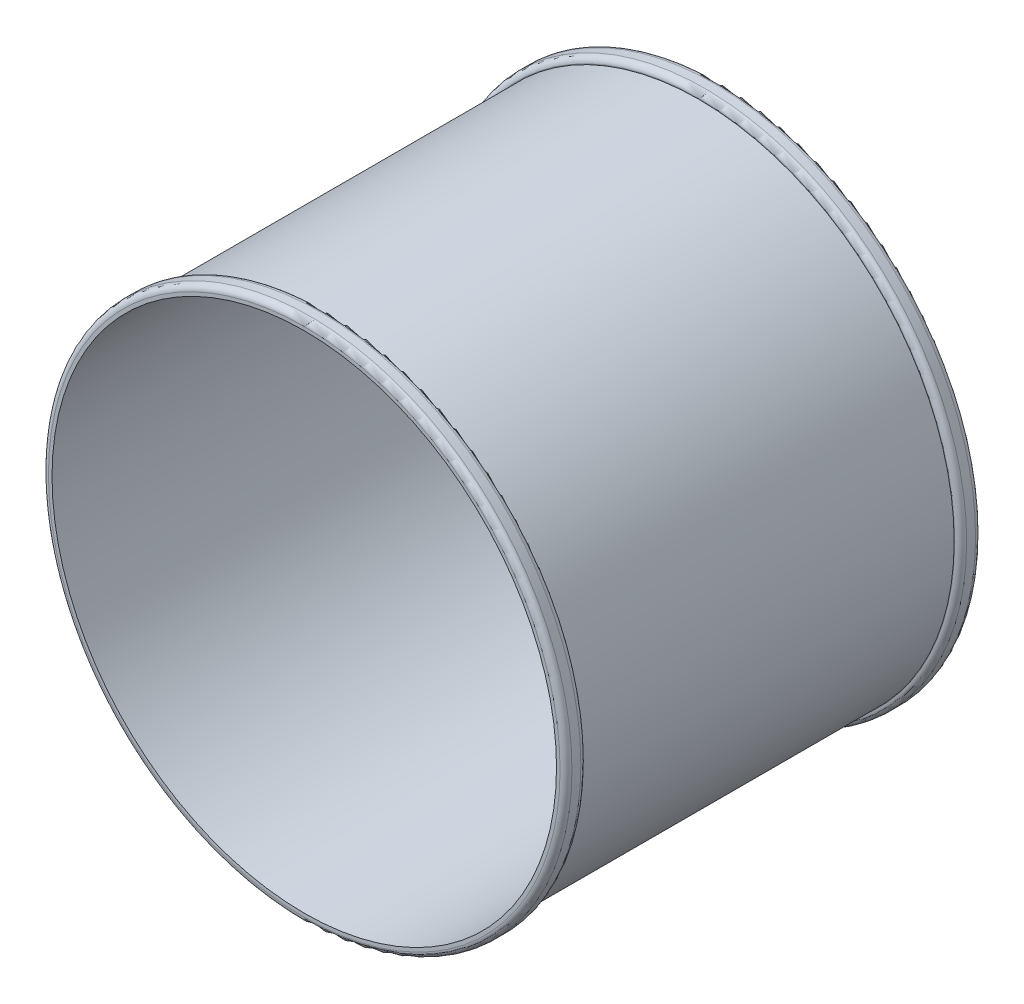
from build123d import *

# Parameters (mm, degrees)
SKETCH1_R            = 43
SKETCH1_R_2          = 42.5
EXTRUDE_THIN1_DEPTH  = 35
EXTRUDE_THIN2_START  = -3.5
SKETCH2_R            = 44.1
SKETCH2_R_2          = 42.5
EXTRUDE_THIN2_DEPTH  = 3.5
FILLET1_R            = 1
FILLET1_OF_MIRROR1_R = 1


with BuildPart() as part:
    # Sketch1 → Extrude-Thin1 (new, symmetric)
    with BuildSketch(Plane.XY):
        Circle(SKETCH1_R)
        Circle(SKETCH1_R_2, mode=Mode.SUBTRACT)
    extrude(amount=EXTRUDE_THIN1_DEPTH, both=True)

    # Sketch2 → Extrude-Thin2 (add)
    with BuildSketch(Plane.XY.offset(35).offset(EXTRUDE_THIN2_START)):
        Circle(SKETCH2_R)
        Circle(SKETCH2_R_2, mode=Mode.SUBTRACT)
    extrude_thin2 = extrude(amount=EXTRUDE_THIN2_DEPTH)

    # Fillet1
    fillet1_edges = [part.edges().sort_by_distance(p)[0] for p in [
        (-44.1, 0, 35),
        (-44.1, 0, 31.5),
    ]]
    fillet(fillet1_edges, radius=FILLET1_R)

    # Mirror1: Extrude-Thin2 across plane
    add(extrude_thin2.mirror(Plane.XY))

    # Fillet1 of Mirror1
    fillet1_of_mirror1_edges = [part.edges().sort_by_distance(p)[0] for p in [
        (-44.1, 0, -35),
        (-44.1, 0, -31.5),
    ]]
    fillet(fillet1_of_mirror1_edges, radius=FILLET1_OF_MIRROR1_R)


solid = part.part
